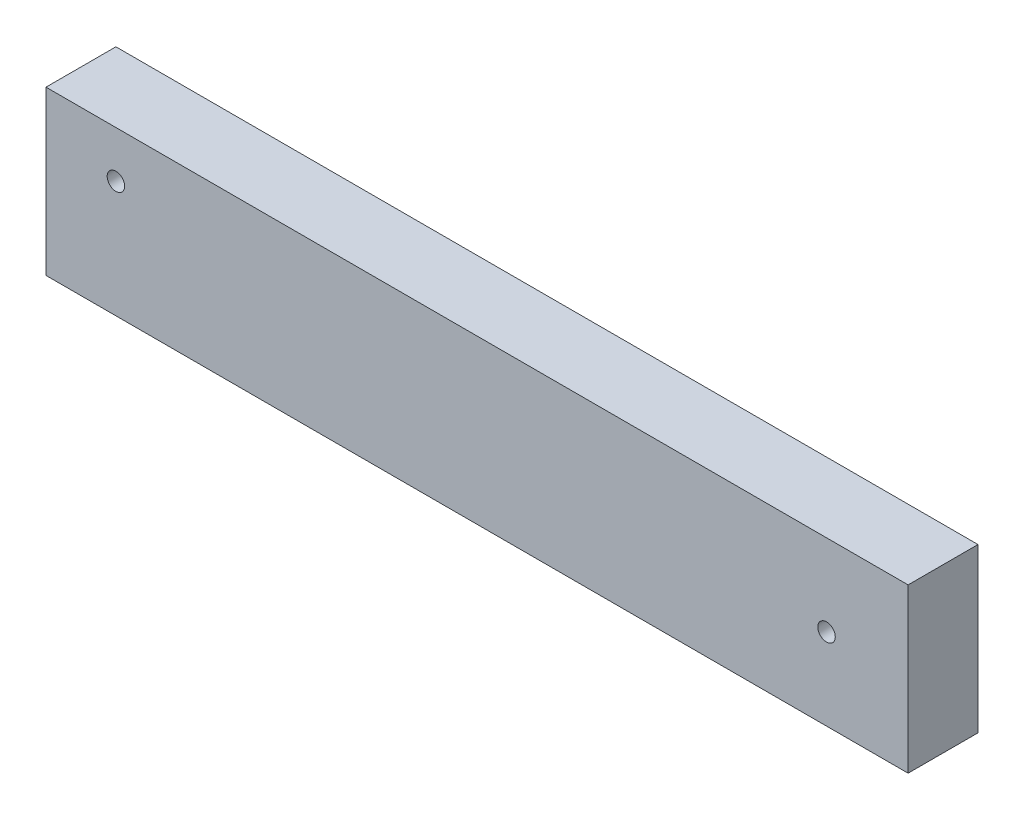
from build123d import *

# Parameters (mm, degrees)
SKETCH1_W           = 469.9
SKETCH1_H           = 88.9
BOSS_EXTRUDE1_DEPTH = 38.1
SKETCH2_R           = 4.7625
CUT_EXTRUDE1_DEPTH  = 480.750799895
SKETCH3_R           = 4.7625
CUT_EXTRUDE2_DEPTH  = 480.750799895


with BuildPart() as part:
    # Sketch1 → Boss-Extrude1 (new body)
    with BuildSketch(Plane.XY):
        with Locations((234.95, 44.45)):
            Rectangle(SKETCH1_W, SKETCH1_H)
    extrude(amount=BOSS_EXTRUDE1_DEPTH)

    # Sketch2 → Cut-Extrude1 (cut, through all)
    with BuildSketch(Plane.XY.offset(38.1)):
        with Locations((425.45, 44.45)):
            Circle(SKETCH2_R)
    extrude(amount=-CUT_EXTRUDE1_DEPTH, mode=Mode.SUBTRACT)

    # Sketch3 → Cut-Extrude2 (cut, through all)
    with BuildSketch(Plane.XY.offset(38.1)):
        with Locations((38.1, 63.5)):
            Circle(SKETCH3_R)
    extrude(amount=-CUT_EXTRUDE2_DEPTH, mode=Mode.SUBTRACT)


solid = part.part
